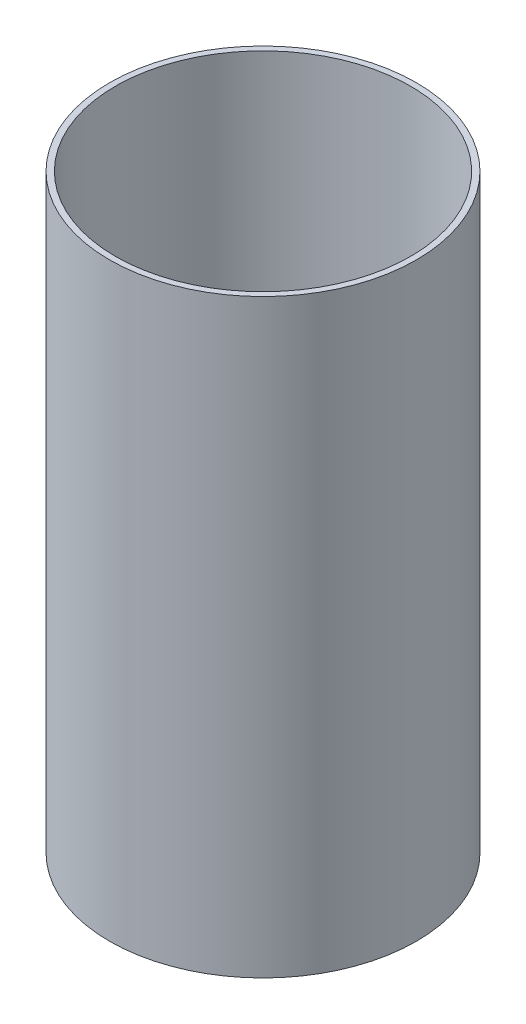
from build123d import *

# Parameters (mm, degrees)
SKETCH1_R           = 26
SKETCH1_R_2         = 25
BOSS_EXTRUDE1_DEPTH = 100


with BuildPart() as part:
    # Sketch1 → Boss-Extrude1 (new body)
    with BuildSketch(Plane(origin=(0, 0, 0), x_dir=(1, 0, 0), z_dir=(0, 1, 0))):
        with Locations(Location((0, 0, 0), (0, 0, 270))):
            Circle(SKETCH1_R)
        with Locations(Location((0, 0, 0), (0, 0, 270))):
            Circle(SKETCH1_R_2, mode=Mode.SUBTRACT)
    extrude(amount=BOSS_EXTRUDE1_DEPTH)


solid = part.part
